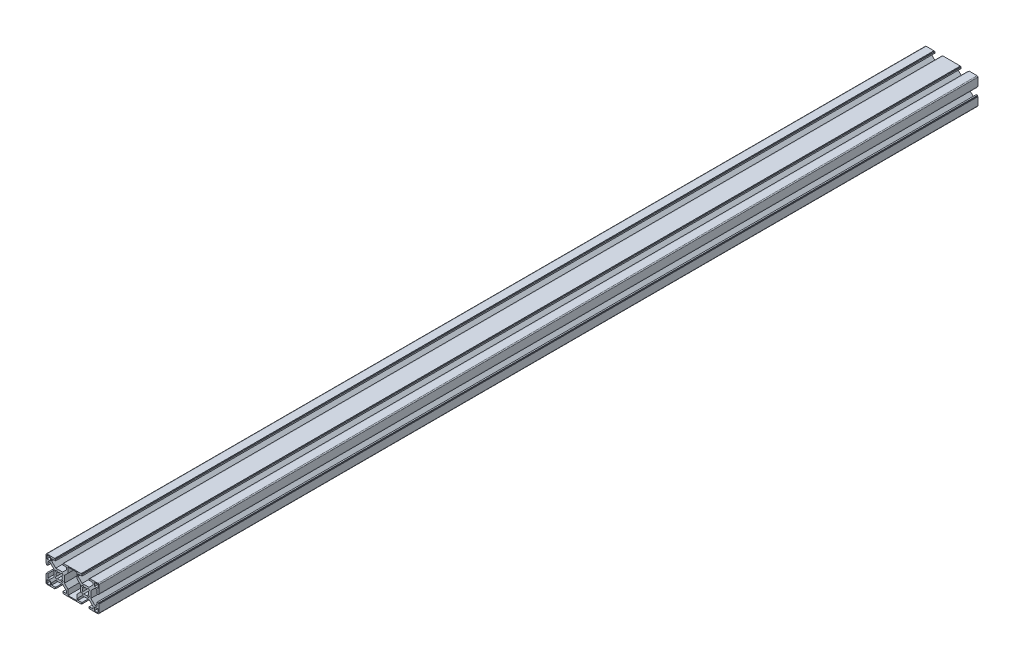
from build123d import *

# Parameters (mm, degrees)
ESBO_O1_W                      = 4
ESBO_O1_H                      = 4
RESSALTO_EXTRUS_O1_DEPTH       = 1000
PADR_OCIRCULAR1_COUNT          = 4
PADR_O_LINEAR1_COUNT           = 2
PADR_O_LINEAR1_PITCH           = 30
PADR_O_LINEAR1_COPY_1_SKETCH_W = 4
PADR_O_LINEAR1_COPY_1_SKETCH_H = 4
PADR_O_LINEAR1_COPY_1_DEPTH    = 1000
PADR_O_LINEAR1_COPY_2_SKETCH_W = 4
PADR_O_LINEAR1_COPY_2_SKETCH_H = 4
PADR_O_LINEAR1_COPY_2_DEPTH    = 1000
PADR_O_LINEAR1_COPY_3_SKETCH_W = 4
PADR_O_LINEAR1_COPY_3_SKETCH_H = 4
PADR_O_LINEAR1_COPY_3_DEPTH    = 1000
ESBO_O4_W                      = 10
ESBO_O4_H                      = 28
CORTE_EXTRUS_O1_DEPTH          = 1002.124367898
FILETE1_R                      = 1


with BuildPart() as part:
    # Esboço1 → Ressalto-extrusão1 (new body)
    with BuildSketch(Plane.XY):
        with BuildLine():
            ThreePointArc((-1.664601464, 3.078815026), (-0.858529967, 3.393070335), (0, 3.5))
            Line((0, 3.5), (0, 6))
            Line((0, 6), (-3.878679656, 6))
            Line((-3.878679656, 6), (-8.5, 10.621320344))
            Line((-8.5, 10.621320344), (-8.5, 13))
            Line((-8.5, 13), (-4.1, 13))
            Line((-4.1, 13), (-4.1, 14.5))
            Line((-4.1, 14.5), (-5.1, 14.5))
            Line((-5.1, 14.5), (-5.1, 15))
            Line((-5.1, 15), (-15, 15))
            Line((-15, 15), (-15, 5.1))
            Line((-15, 5.1), (-14.5, 5.1))
            Line((-14.5, 5.1), (-14.5, 4.1))
            Line((-14.5, 4.1), (-13, 4.1))
            Line((-13, 4.1), (-13, 8.5))
            Line((-13, 8.5), (-10.621320344, 8.5))
            Line((-10.621320344, 8.5), (-6, 3.878679656))
            Line((-6, 3.878679656), (-6, 0))
            Line((-6, 0), (-3.5, 0))
            ThreePointArc((-3.5, 0), (-3.393070335, 0.858529967), (-3.078815026, 1.664601464))
            Line((-3.078815026, 1.664601464), (-4.596194078, 3.181980515))
            Line((-4.596194078, 3.181980515), (-3.181980515, 4.596194078))
            Line((-3.181980515, 4.596194078), (-1.664601464, 3.078815026))
        make_face()
        with Locations((-12, 12)):
            Rectangle(ESBO_O1_W, ESBO_O1_H, mode=Mode.SUBTRACT)
    ressalto_extrus_o1 = extrude(amount=RESSALTO_EXTRUS_O1_DEPTH)

    # PadrãoCircular1: Ressalto-extrusão1 ×4 about axis
    padr_ocircular1_axis = Axis((0, 0, 0), (0, 0, 1))
    for i in range(1, PADR_OCIRCULAR1_COUNT):
        add(ressalto_extrus_o1.rotate(padr_ocircular1_axis, i * 360 / PADR_OCIRCULAR1_COUNT))

    # Padrão linear1: Ressalto-extrusão1 ×2
    with Locations(*[(i * PADR_O_LINEAR1_PITCH, 0, 0) for i in range(1, PADR_O_LINEAR1_COUNT)]):
        add(ressalto_extrus_o1)

    # Padrão linear1 copy 1 sketch → Padrão linear1 copy 1 (add)
    with BuildSketch(Plane(origin=(30, 0, 0), x_dir=(0, 1, 0), z_dir=(0, 0, 1))):
        with BuildLine():
            ThreePointArc((-1.664601464, 3.078815026), (-0.858529967, 3.393070335), (0, 3.5))
            Line((0, 3.5), (0, 6))
            Line((0, 6), (-3.878679656, 6))
            Line((-3.878679656, 6), (-8.5, 10.621320344))
            Line((-8.5, 10.621320344), (-8.5, 13))
            Line((-8.5, 13), (-4.1, 13))
            Line((-4.1, 13), (-4.1, 14.5))
            Line((-4.1, 14.5), (-5.1, 14.5))
            Line((-5.1, 14.5), (-5.1, 15))
            Line((-5.1, 15), (-15, 15))
            Line((-15, 15), (-15, 5.1))
            Line((-15, 5.1), (-14.5, 5.1))
            Line((-14.5, 5.1), (-14.5, 4.1))
            Line((-14.5, 4.1), (-13, 4.1))
            Line((-13, 4.1), (-13, 8.5))
            Line((-13, 8.5), (-10.621320344, 8.5))
            Line((-10.621320344, 8.5), (-6, 3.878679656))
            Line((-6, 3.878679656), (-6, 0))
            Line((-6, 0), (-3.5, 0))
            ThreePointArc((-3.5, 0), (-3.393070335, 0.858529967), (-3.078815026, 1.664601464))
            Line((-3.078815026, 1.664601464), (-4.596194078, 3.181980515))
            Line((-4.596194078, 3.181980515), (-3.181980515, 4.596194078))
            Line((-3.181980515, 4.596194078), (-1.664601464, 3.078815026))
        make_face()
        with Locations((-12, 12)):
            Rectangle(PADR_O_LINEAR1_COPY_1_SKETCH_W, PADR_O_LINEAR1_COPY_1_SKETCH_H, mode=Mode.SUBTRACT)
    extrude(amount=PADR_O_LINEAR1_COPY_1_DEPTH)

    # Padrão linear1 copy 2 sketch → Padrão linear1 copy 2 (add)
    with BuildSketch(Plane(origin=(30, 0, 0), x_dir=(-1, 0, 0), z_dir=(0, 0, 1))):
        with BuildLine():
            ThreePointArc((-1.664601464, 3.078815026), (-0.858529967, 3.393070335), (0, 3.5))
            Line((0, 3.5), (0, 6))
            Line((0, 6), (-3.878679656, 6))
            Line((-3.878679656, 6), (-8.5, 10.621320344))
            Line((-8.5, 10.621320344), (-8.5, 13))
            Line((-8.5, 13), (-4.1, 13))
            Line((-4.1, 13), (-4.1, 14.5))
            Line((-4.1, 14.5), (-5.1, 14.5))
            Line((-5.1, 14.5), (-5.1, 15))
            Line((-5.1, 15), (-15, 15))
            Line((-15, 15), (-15, 5.1))
            Line((-15, 5.1), (-14.5, 5.1))
            Line((-14.5, 5.1), (-14.5, 4.1))
            Line((-14.5, 4.1), (-13, 4.1))
            Line((-13, 4.1), (-13, 8.5))
            Line((-13, 8.5), (-10.621320344, 8.5))
            Line((-10.621320344, 8.5), (-6, 3.878679656))
            Line((-6, 3.878679656), (-6, 0))
            Line((-6, 0), (-3.5, 0))
            ThreePointArc((-3.5, 0), (-3.393070335, 0.858529967), (-3.078815026, 1.664601464))
            Line((-3.078815026, 1.664601464), (-4.596194078, 3.181980515))
            Line((-4.596194078, 3.181980515), (-3.181980515, 4.596194078))
            Line((-3.181980515, 4.596194078), (-1.664601464, 3.078815026))
        make_face()
        with Locations((-12, 12)):
            Rectangle(PADR_O_LINEAR1_COPY_2_SKETCH_W, PADR_O_LINEAR1_COPY_2_SKETCH_H, mode=Mode.SUBTRACT)
    extrude(amount=PADR_O_LINEAR1_COPY_2_DEPTH)

    # Padrão linear1 copy 3 sketch → Padrão linear1 copy 3 (add)
    with BuildSketch(Plane(origin=(30, 0, 0), x_dir=(0, -1, 0), z_dir=(0, 0, 1))):
        with BuildLine():
            ThreePointArc((-1.664601464, 3.078815026), (-0.858529967, 3.393070335), (0, 3.5))
            Line((0, 3.5), (0, 6))
            Line((0, 6), (-3.878679656, 6))
            Line((-3.878679656, 6), (-8.5, 10.621320344))
            Line((-8.5, 10.621320344), (-8.5, 13))
            Line((-8.5, 13), (-4.1, 13))
            Line((-4.1, 13), (-4.1, 14.5))
            Line((-4.1, 14.5), (-5.1, 14.5))
            Line((-5.1, 14.5), (-5.1, 15))
            Line((-5.1, 15), (-15, 15))
            Line((-15, 15), (-15, 5.1))
            Line((-15, 5.1), (-14.5, 5.1))
            Line((-14.5, 5.1), (-14.5, 4.1))
            Line((-14.5, 4.1), (-13, 4.1))
            Line((-13, 4.1), (-13, 8.5))
            Line((-13, 8.5), (-10.621320344, 8.5))
            Line((-10.621320344, 8.5), (-6, 3.878679656))
            Line((-6, 3.878679656), (-6, 0))
            Line((-6, 0), (-3.5, 0))
            ThreePointArc((-3.5, 0), (-3.393070335, 0.858529967), (-3.078815026, 1.664601464))
            Line((-3.078815026, 1.664601464), (-4.596194078, 3.181980515))
            Line((-4.596194078, 3.181980515), (-3.181980515, 4.596194078))
            Line((-3.181980515, 4.596194078), (-1.664601464, 3.078815026))
        make_face()
        with Locations((-12, 12)):
            Rectangle(PADR_O_LINEAR1_COPY_3_SKETCH_W, PADR_O_LINEAR1_COPY_3_SKETCH_H, mode=Mode.SUBTRACT)
    extrude(amount=PADR_O_LINEAR1_COPY_3_DEPTH)

    # Esboço4 → Corte-extrusão1 (cut, through all)
    with BuildSketch(Plane(origin=(0, 0, 0), x_dir=(-1, 0, 0), z_dir=(0, 0, -1))):
        with Locations((-15, 0)):
            Rectangle(ESBO_O4_W, ESBO_O4_H)
    extrude(amount=-CORTE_EXTRUS_O1_DEPTH, mode=Mode.SUBTRACT)

    # Filete1
    filete1_edges = [part.edges().sort_by_distance(p)[0] for p in [
        (45, -15, 500),
        (45, 15, 500),
        (-15, 15, 500),
        (-15, -15, 500),
    ]]
    fillet(filete1_edges, radius=FILETE1_R)


solid = part.part
